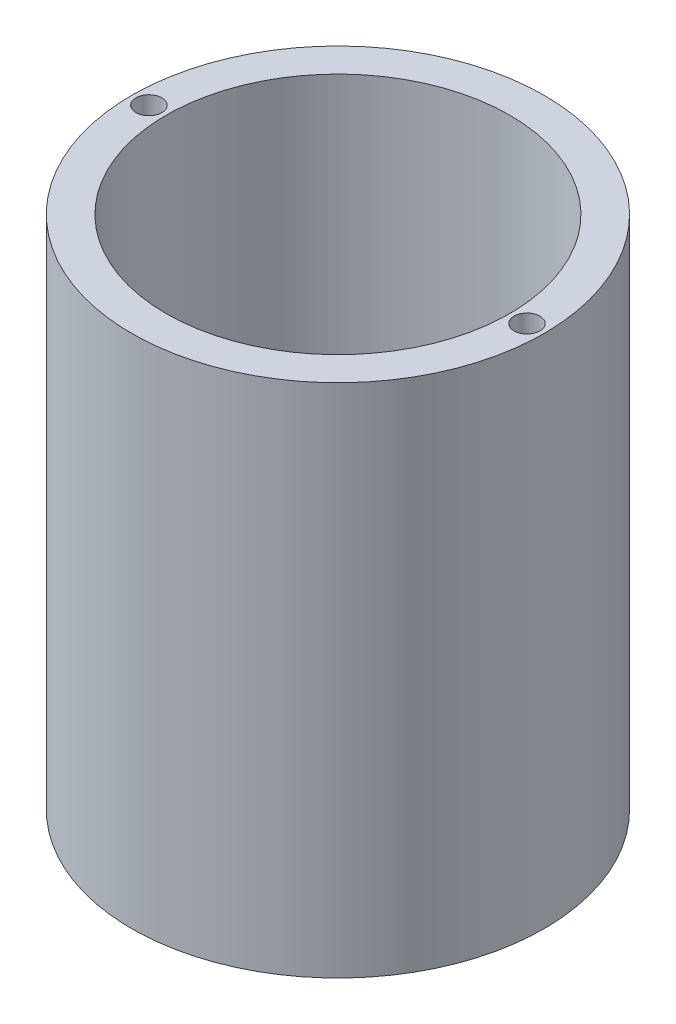
from build123d import *

# Parameters (mm, degrees)
SKETCH1_R           = 15.24
SKETCH1_R_2         = 12.7
BOSS_EXTRUDE1_DEPTH = 38.1
SKETCH2_R           = 0.9525
CUT_EXTRUDE1_DEPTH  = 5.08


with BuildPart() as part:
    # Sketch1 → Boss-Extrude1 (new body)
    with BuildSketch(Plane(origin=(0, 0, 0), x_dir=(1, 0, 0), z_dir=(0, 1, 0))):
        with Locations(Location((0, 0, 0), (0, 0, 90))):
            Circle(SKETCH1_R)
        with Locations(Location((0, 0, 0), (0, 0, 90))):
            Circle(SKETCH1_R_2, mode=Mode.SUBTRACT)
    extrude(amount=BOSS_EXTRUDE1_DEPTH)

    # Sketch2 → Cut-Extrude1 (cut)
    with BuildSketch(Plane(origin=(0, 38.1, 0), x_dir=(1, 0, 0), z_dir=(0, 1, 0))):
        with Locations(Location((-13.97, 0, 0), (0, 0, 270))):
            Circle(SKETCH2_R)
        with Locations(Location((13.97, 0, 0), (0, 0, 270))):
            Circle(SKETCH2_R)
    extrude(amount=-CUT_EXTRUDE1_DEPTH, mode=Mode.SUBTRACT)


solid = part.part
